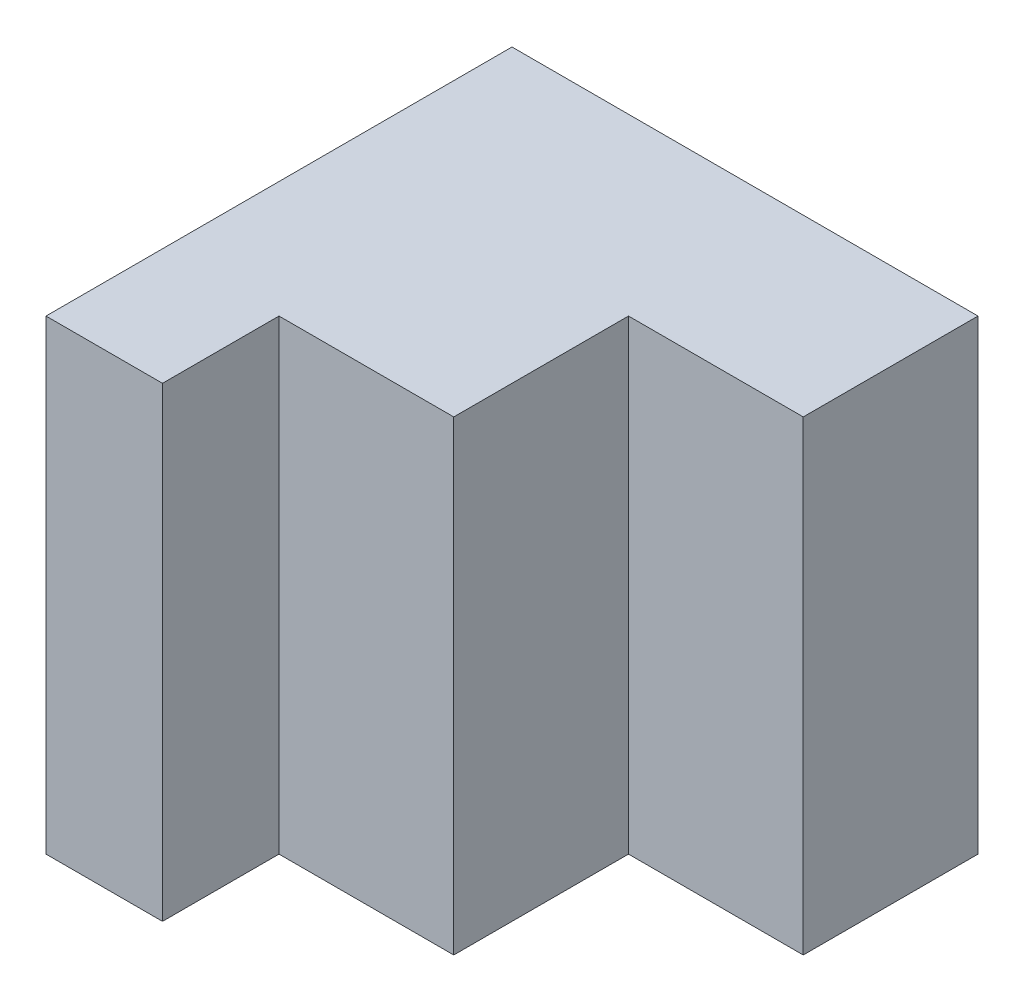
from build123d import *

# Parameters (mm, degrees)
SKETCH1_W           = 10
SKETCH1_H           = 40
BOSS_EXTRUDE3_DEPTH = 40
SKETCH1_5_W         = 15
SKETCH1_5_H         = 40
BOSS_EXTRUDE4_DEPTH = 30
SKETCH1_6_W         = 15
SKETCH1_6_H         = 40
BOSS_EXTRUDE5_DEPTH = 15


with BuildPart() as part:
    # Sketch1 → Boss-Extrude3 (new body)
    with BuildSketch(Plane.XY):
        with Locations((-35, 20)):
            Rectangle(SKETCH1_W, SKETCH1_H)
    extrude(amount=BOSS_EXTRUDE3_DEPTH)

    # Sketch1<5> → Boss-Extrude4 (add)
    with BuildSketch(Plane.XY):
        with Locations((-22.5, 20)):
            Rectangle(SKETCH1_5_W, SKETCH1_5_H)
    extrude(amount=BOSS_EXTRUDE4_DEPTH)

    # Sketch1<6> → Boss-Extrude5 (add)
    with BuildSketch(Plane.XY):
        with Locations((-7.5, 20)):
            Rectangle(SKETCH1_6_W, SKETCH1_6_H)
    extrude(amount=BOSS_EXTRUDE5_DEPTH)


solid = part.part
